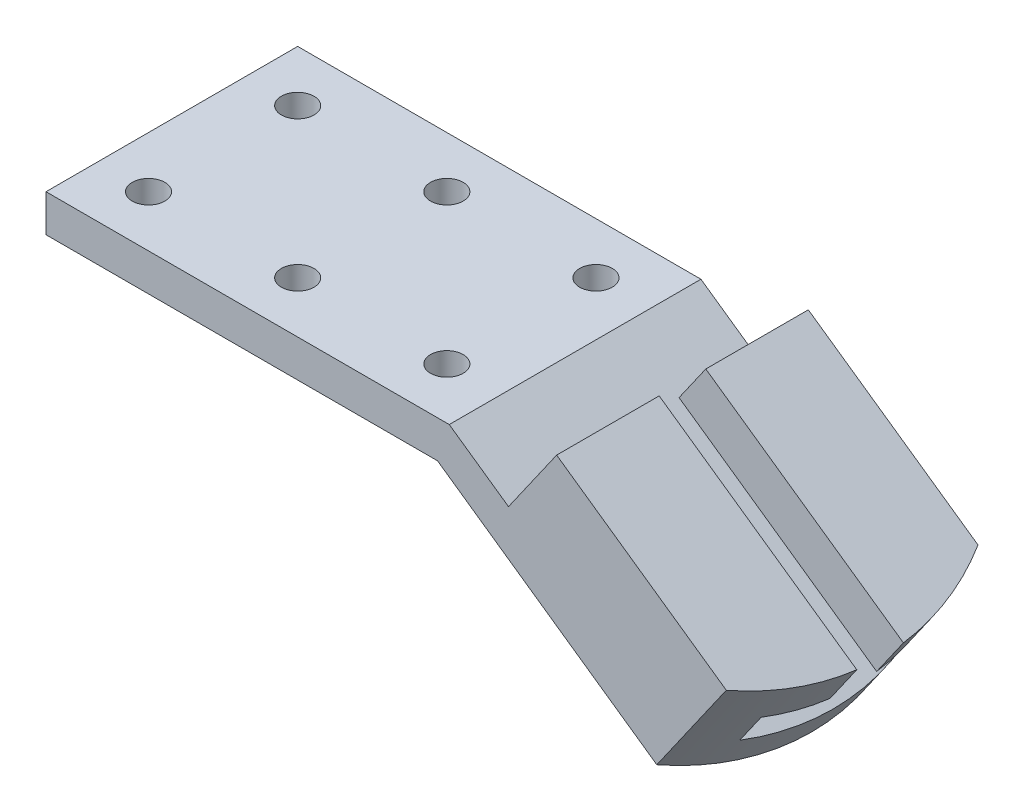
from build123d import *

# Parameters (mm, degrees)
BOSS_EXTRUDE1_DEPTH = 27
SKETCH2_R           = 3.5
CUT_EXTRUDE1_DEPTH  = 8
CUT_EXTRUDE2_DEPTH  = 53.574815946
CUT_EXTRUDE3_REACH  = 151.521
SKETCH5_W           = 1.574815946
SKETCH5_H           = 22
CUT_EXTRUDE4_REACH  = 151.521


with BuildPart() as part:
    # Sketch1 → Boss-Extrude1 (new, symmetric)
    with BuildSketch(Plane.XY):
        Polygon((0, 0), (0, 8), (86.522390311, 8), (97.947574365, 0), (108.271950219, 14.744736797), (152.157870224, -15.984515211), (137.244882879, -37.282468363), (84, 0), align=None)
    extrude(amount=BOSS_EXTRUDE1_DEPTH, both=True)

    # Sketch2 → Cut-Extrude1 (cut)
    with BuildSketch(Plane(origin=(0, 8, 0), x_dir=(1, 0, 0), z_dir=(0, 1, 0))):
        with Locations(Location((11, 16, 0), (0, 0, 180))):
            Circle(SKETCH2_R)
        with Locations(Location((43, 16, 0), (0, 0, 180))):
            Circle(SKETCH2_R)
        with Locations(Location((75, 16, 0), (0, 0, 180))):
            Circle(SKETCH2_R)
        with Locations(Location((11, -16, 0), (0, 0, 180))):
            Circle(SKETCH2_R)
        with Locations(Location((43, -16, 0), (0, 0, 180))):
            Circle(SKETCH2_R)
        with Locations(Location((75, -16, 0), (0, 0, 180))):
            Circle(SKETCH2_R)
    extrude(amount=-CUT_EXTRUDE1_DEPTH, mode=Mode.SUBTRACT)

    # Sketch4 → Cut-Extrude2 (cut)
    with BuildSketch(Plane(origin=(109.609728898, -76.749558436, 0), x_dir=(0, 0, -1), z_dir=(0.8191520442889955, -0.5735764363510408, 0))):
        Polygon((-17.5, 56.180420653), (0, 56.180420653), (0, 74.180420653), (-5, 74.180420653), (-5, 64.180420653), (-17.5, 64.180420653), align=None)
        Polygon((0, 74.180420653), (0, 56.180420653), (17.5, 56.180420653), (17.5, 64.180420653), (5, 64.180420653), (5, 74.180420653), align=None)
    extrude(amount=-CUT_EXTRUDE2_DEPTH, mode=Mode.SUBTRACT)

    # Cut-Extrude3: up to this face of the body (flat: up to its plane)
    cut_extrude3_end = Plane(part.part.faces().sort_by_distance((111.965486474, -9.815447728, 0))[0])
    # Sketch5 → Cut-Extrude3 (cut, up to the picked face)
    with BuildSketch(Plane(origin=(42.548141325, 60.765043225, 0), x_dir=(0.8191520442889958, -0.5735764363510405, 0), z_dir=(0.5735764363510404, 0.8191520442889957, 0)), mode=Mode.PRIVATE) as cut_extrude3_sk1:
        with Locations((81.021363747, 16)):
            Rectangle(SKETCH5_W, SKETCH5_H)
    cut_extrude3_tool1 = split(extrude(cut_extrude3_sk1.sketch, amount=-CUT_EXTRUDE3_REACH, mode=Mode.PRIVATE), bisect_by=cut_extrude3_end, keep=Keep.BOTH, mode=Mode.PRIVATE)
    # Sketch5 → Cut-Extrude3 (cut, up to the picked face)
    with BuildSketch(Plane(origin=(42.548141325, 60.765043225, 0), x_dir=(0.8191520442889958, -0.5735764363510405, 0), z_dir=(0.5735764363510404, 0.8191520442889957, 0)), mode=Mode.PRIVATE) as cut_extrude3_sk2:
        with Locations((81.021363747, -16)):
            Rectangle(SKETCH5_W, SKETCH5_H)
    cut_extrude3_tool2 = split(extrude(cut_extrude3_sk2.sketch, amount=-CUT_EXTRUDE3_REACH, mode=Mode.PRIVATE), bisect_by=cut_extrude3_end, keep=Keep.BOTH, mode=Mode.PRIVATE)
    add(cut_extrude3_tool1.solids().sort_by(Axis((108.916957, 14.293098, -16), (-0.5735764363510404, -0.8191520442889957, 0)))[0], mode=Mode.SUBTRACT)
    add(cut_extrude3_tool2.solids().sort_by(Axis((108.916957, 14.293098, 16), (-0.5735764363510404, -0.8191520442889957, 0)))[0], mode=Mode.SUBTRACT)

    # Cut-Extrude4: up to this face of the body (flat: up to its plane)
    cut_extrude4_end = Plane(part.part.faces().sort_by_distance((110.622441439, -18.641234181, 0))[0])
    # Sketch5<4> → Cut-Extrude4 (cut, up to the picked face)
    with BuildSketch(Plane(origin=(42.548141325, 60.765043225, 0), x_dir=(0.8191520442889958, -0.5735764363510405, 0), z_dir=(0.5735764363510404, 0.8191520442889957, 0)), mode=Mode.PRIVATE) as cut_extrude4_sk1:
        with BuildLine():
            Line((126.249743807, -27), (133.80877172, -27))
            Line((133.80877172, -27), (133.80877172, -17.5))
            Line((133.80877172, -17.5), (133.80877172, -5))
            Line((133.80877172, -5), (133.80877172, 0))
            ThreePointArc((133.80877172, 0), (131.883368816, -14.019084341), (126.249743807, -27))
        make_face()
    cut_extrude4_tool1 = split(extrude(cut_extrude4_sk1.sketch, amount=-CUT_EXTRUDE4_REACH, mode=Mode.PRIVATE), bisect_by=cut_extrude4_end, keep=Keep.BOTH, mode=Mode.PRIVATE)
    # Sketch5<4> → Cut-Extrude4 (cut, up to the picked face)
    with BuildSketch(Plane(origin=(42.548141325, 60.765043225, 0), x_dir=(0.8191520442889958, -0.5735764363510405, 0), z_dir=(0.5735764363510404, 0.8191520442889957, 0)), mode=Mode.PRIVATE) as cut_extrude4_sk2:
        with BuildLine():
            Line((133.567828899, 5), (133.80877172, 5))
            Line((133.80877172, 5), (133.80877172, 17.5))
            Line((133.80877172, 17.5), (133.80877172, 27))
            Line((133.80877172, 27), (126.249743807, 27))
            ThreePointArc((126.249743807, 27), (131.150553282, 16.413061639), (133.567828899, 5))
        make_face()
    cut_extrude4_tool2 = split(extrude(cut_extrude4_sk2.sketch, amount=-CUT_EXTRUDE4_REACH, mode=Mode.PRIVATE), bisect_by=cut_extrude4_end, keep=Keep.BOTH, mode=Mode.PRIVATE)
    # Sketch5<4> → Cut-Extrude4 (cut, up to the picked face)
    with BuildSketch(Plane(origin=(42.548141325, 60.765043225, 0), x_dir=(0.8191520442889958, -0.5735764363510405, 0), z_dir=(0.5735764363510404, 0.8191520442889957, 0)), mode=Mode.PRIVATE) as cut_extrude4_sk3:
        with BuildLine():
            ThreePointArc((133.567828899, 5), (133.748501087, 2.502900989), (133.80877172, 0))
            Line((133.80877172, 0), (133.80877172, 5))
            Line((133.80877172, 5), (133.567828899, 5))
        make_face()
    cut_extrude4_tool3 = split(extrude(cut_extrude4_sk3.sketch, amount=-CUT_EXTRUDE4_REACH, mode=Mode.PRIVATE), bisect_by=cut_extrude4_end, keep=Keep.BOTH, mode=Mode.PRIVATE)
    add(cut_extrude4_tool1.solids().sort_by(Axis((150.325954, -14.701794, 20.352048), (-0.5735764363510404, -0.8191520442889957, 0)))[0], mode=Mode.SUBTRACT)
    add(cut_extrude4_tool2.solids().sort_by(Axis((150.3151, -14.694193, -20.453703), (-0.5735764363510404, -0.8191520442889957, 0)))[0], mode=Mode.SUBTRACT)
    add(cut_extrude4_tool3.solids().sort_by(Axis((152.098683, -15.943072, -3.75058), (-0.5735764363510404, -0.8191520442889957, 0)))[0], mode=Mode.SUBTRACT)


solid = part.part
